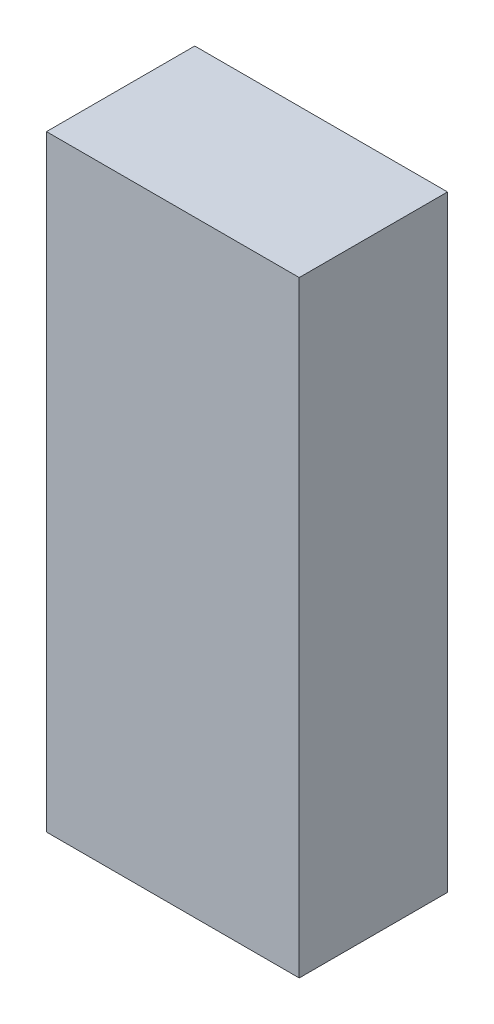
from build123d import *

# Parameters (mm, degrees)
SKETCH1_W           = 9.525
SKETCH1_H           = 22.86
BOSS_EXTRUDE1_DEPTH = 5.588


with BuildPart() as part:
    # Sketch1 → Boss-Extrude1 (new body)
    with BuildSketch(Plane.XY):
        with Locations((4.7625, 11.43)):
            Rectangle(SKETCH1_W, SKETCH1_H)
    extrude(amount=BOSS_EXTRUDE1_DEPTH)


solid = part.part
